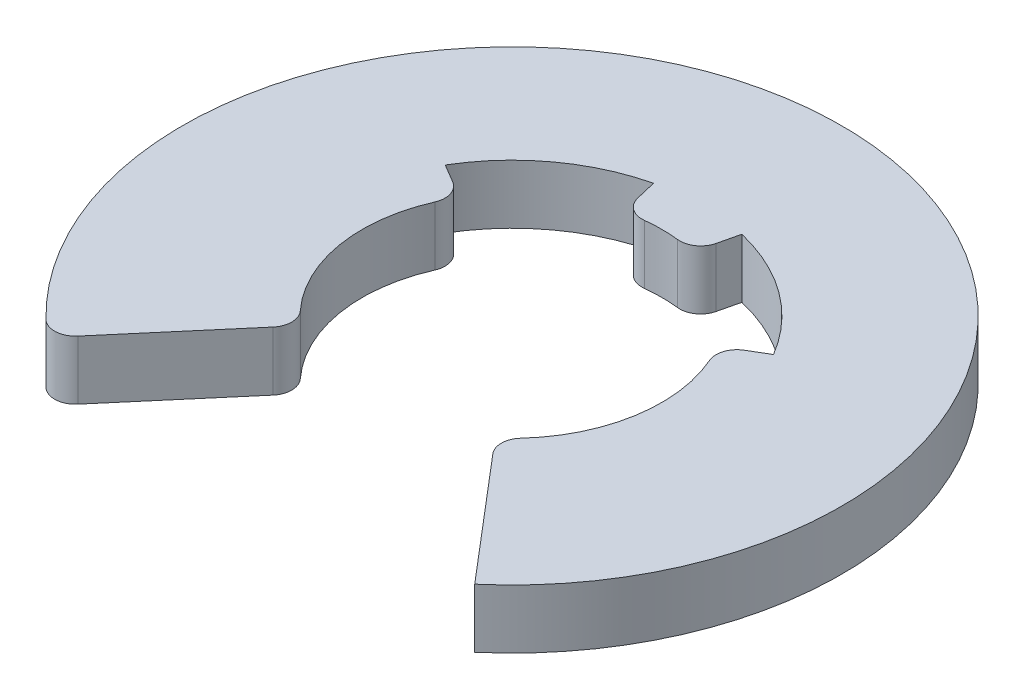
from build123d import *

# Parameters (mm, degrees)
BOSS_EXTRUDE1_DEPTH = 0.2125
FILLET1_R           = 0.15


with BuildPart() as part:
    # Sketch1 → Boss-Extrude1 (new, symmetric)
    with BuildSketch(Plane(origin=(0, 0, 0), x_dir=(1, 0, 0), z_dir=(0, 1, 0))):
        with BuildLine():
            Line((-0.318287037, 1.337654052), (-0.25, 1.050666455))
            ThreePointArc((-0.25, 1.050666455), (0, 1.08), (0.25, 1.050666455))
            Line((0.25, 1.050666455), (0.318287037, 1.337654052))
            ThreePointArc((0.318287037, 1.337654052), (0.815262336, 1.107236345), (1.182840592, 0.701079978))
            Line((1.182840592, 0.701079978), (0.929067519, 0.550666455))
            ThreePointArc((0.929067519, 0.550666455), (1.065278098, -0.177714864), (0.7, -0.822435408))
            Line((0.7, -0.822435408), (1.539351852, -1.808596383))
            ThreePointArc((1.539351852, -1.808596383), (0, 2.375), (-1.539351852, -1.808596383))
            Line((-1.539351852, -1.808596383), (-0.7, -0.822435408))
            ThreePointArc((-0.7, -0.822435408), (-1.065278098, -0.177714864), (-0.929067519, 0.550666455))
            Line((-0.929067519, 0.550666455), (-1.182840592, 0.701079978))
            ThreePointArc((-1.182840592, 0.701079978), (-0.815262336, 1.107236345), (-0.318287037, 1.337654052))
        make_face()
    extrude(amount=BOSS_EXTRUDE1_DEPTH, both=True)

    # Fillet1
    fillet1_edges = [part.edges().sort_by_distance(p)[0] for p in [
        (-0.929067519, 0, -0.550666455),
        (-0.7, 0, 0.822435408),
        (-1.539351852, 0, 1.808596383),
        (0.7, 0, 0.822435408),
        (0.929067519, 0, -0.550666455),
        (0.25, 0, -1.050666455),
        (-0.25, 0, -1.050666455),
    ]]
    fillet(fillet1_edges, radius=FILLET1_R)


solid = part.part
